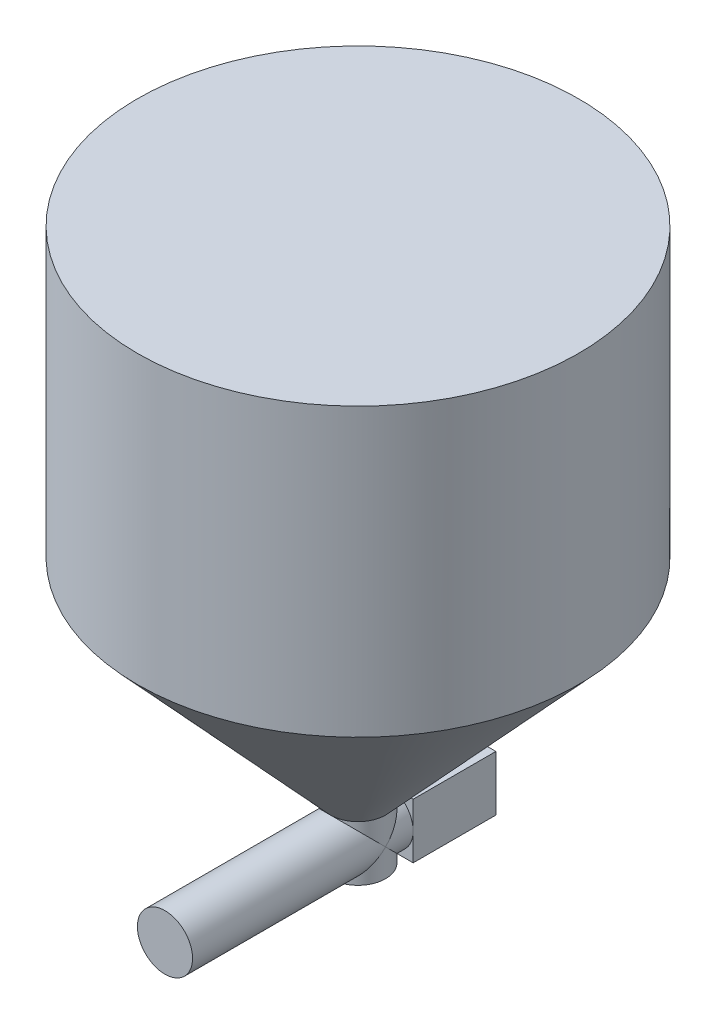
from build123d import *

# Parameters (mm, degrees)
CROQUIS1_R              = 400
SALIENTE_EXTRUIR1_DEPTH = 520
CROQUIS3_R              = 50
CROQUIS2_R              = 400
CROQUIS4_R              = 50
SALIENTE_EXTRUIR2_DEPTH = 100
CROQUIS5_R              = 50
SALIENTE_EXTRUIR3_DEPTH = 400
CROQUIS6_W              = 100
CROQUIS6_H              = 100
SALIENTE_EXTRUIR4_DEPTH = 150


with BuildPart() as part:
    # Croquis1 → Saliente-Extruir1 (new body)
    with BuildSketch(Plane(origin=(0, 0, 0), x_dir=(1, 0, 0), z_dir=(0, 1, 0))):
        with Locations(Location((0, 0, 0), (0, 0, 270))):
            Circle(CROQUIS1_R)
    extrude(amount=-SALIENTE_EXTRUIR1_DEPTH)

    # Croquis3 → Recubrir1 section 0
    with BuildSketch(Plane(origin=(0, -900, 0), x_dir=(1, 0, 0), z_dir=(0, 1, 0))):
        Circle(CROQUIS3_R)
    # Croquis2 → Recubrir1 section 1
    with BuildSketch(Plane.XZ.offset(520)):
        Circle(CROQUIS2_R)
    loft()

    # Croquis4 → Saliente-Extruir2 (add)
    with BuildSketch(Plane.XZ.offset(900)):
        with Locations(Location((0, 0, 0), (0, 0, 270))):
            Circle(CROQUIS4_R)
    extrude(amount=SALIENTE_EXTRUIR2_DEPTH)

    # Croquis5 → Saliente-Extruir3 (add)
    with BuildSketch(Plane(origin=(0, 0, -50), x_dir=(-1, 0, 0), z_dir=(0, 0, -1))):
        with Locations((0, -950)):
            Circle(CROQUIS5_R)
    extrude(amount=-SALIENTE_EXTRUIR3_DEPTH)

    # Croquis6 → Saliente-Extruir4 (add)
    with BuildSketch(Plane(origin=(0, 0, -50), x_dir=(-1, 0, 0), z_dir=(0, 0, -1))):
        with Locations((0, -950)):
            Rectangle(CROQUIS6_W, CROQUIS6_H)
    extrude(amount=SALIENTE_EXTRUIR4_DEPTH)


solid = part.part
